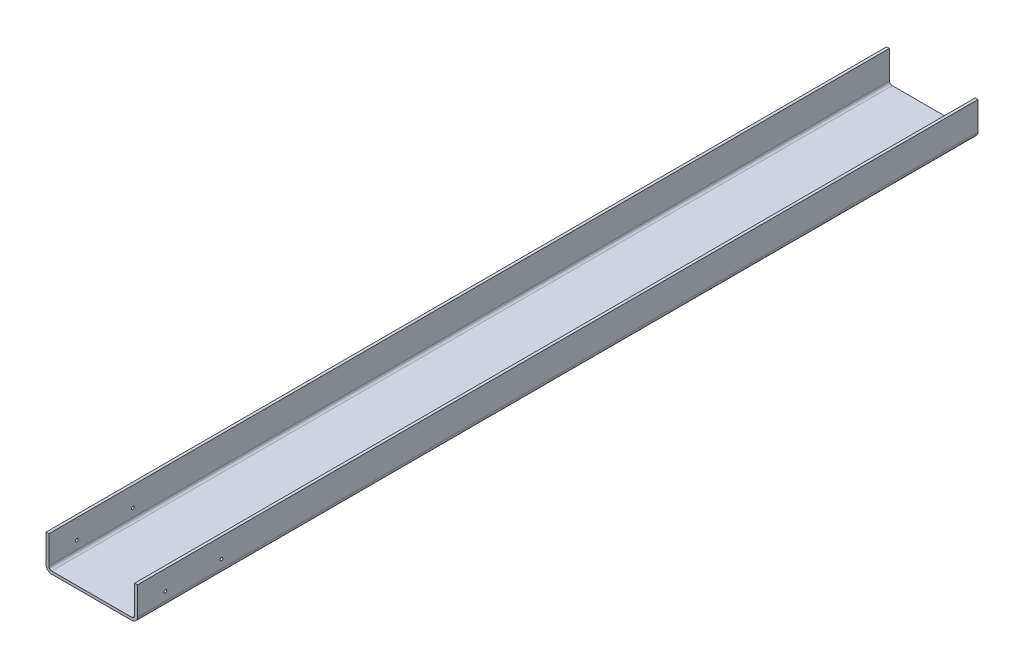
from build123d import *

# Parameters (mm, degrees)
EXTRUDE_1_DEPTH          = 750
CUT_EXTRUDE_1_DEPTH      = 770.849985387
CUT_EXTRUDE_1_DEPTH_BACK = 770.849985387
SKETCH_2_R               = 2
HOLE_WIZARD_M61_D        = 5


with BuildPart() as part:
    # Эскиз1 → Бобышка-Вытянуть1 (new, symmetric)
    with BuildSketch(Plane.XY):
        with BuildLine():
            Line((71.5, 0), (-71.5, 0))
            ThreePointArc((-71.5, 0), (-78.571067812, 2.928932188), (-81.5, 10))
            Line((-81.5, 10), (-81.5, 60))
            Line((-81.5, 60), (-76.5, 60))
            Line((-76.5, 60), (-76.5, 10))
            ThreePointArc((-76.5, 10), (-75.035533906, 6.464466094), (-71.5, 5))
            Line((-71.5, 5), (71.5, 5))
            ThreePointArc((71.5, 5), (75.035533906, 6.464466094), (76.5, 10))
            Line((76.5, 10), (76.5, 60))
            Line((76.5, 60), (81.5, 60))
            Line((81.5, 60), (81.5, 10))
            ThreePointArc((81.5, 10), (78.571067812, 2.928932188), (71.5, 0))
        make_face()
    extrude(amount=EXTRUDE_1_DEPTH, both=True)

    # Эскиз2 → Вырез-Вытянуть1 (cut, two sides: drawn at the far end of the back side and taken through both)
    with BuildSketch(Plane(origin=(81.5, 0, 0), x_dir=(0, 0, -1), z_dir=(1, 0, 0)).offset(-CUT_EXTRUDE_1_DEPTH_BACK)):
        with Locations((-600, 24.9115)):
            Circle(SKETCH_2_R)
        with Locations((-700, 24.9115)):
            Circle(SKETCH_2_R)
    extrude(amount=CUT_EXTRUDE_1_DEPTH + CUT_EXTRUDE_1_DEPTH_BACK, mode=Mode.SUBTRACT)

    # Отверстие обработанное метчиком M61 (through all)
    with Locations(Plane(origin=(81.5, 0, 0), x_dir=(0, 0, -1), z_dir=(1, 0, 0))):
        with Locations((-600, 24.9115), (-700, 24.9115)):
            Hole(HOLE_WIZARD_M61_D / 2)


solid = part.part
